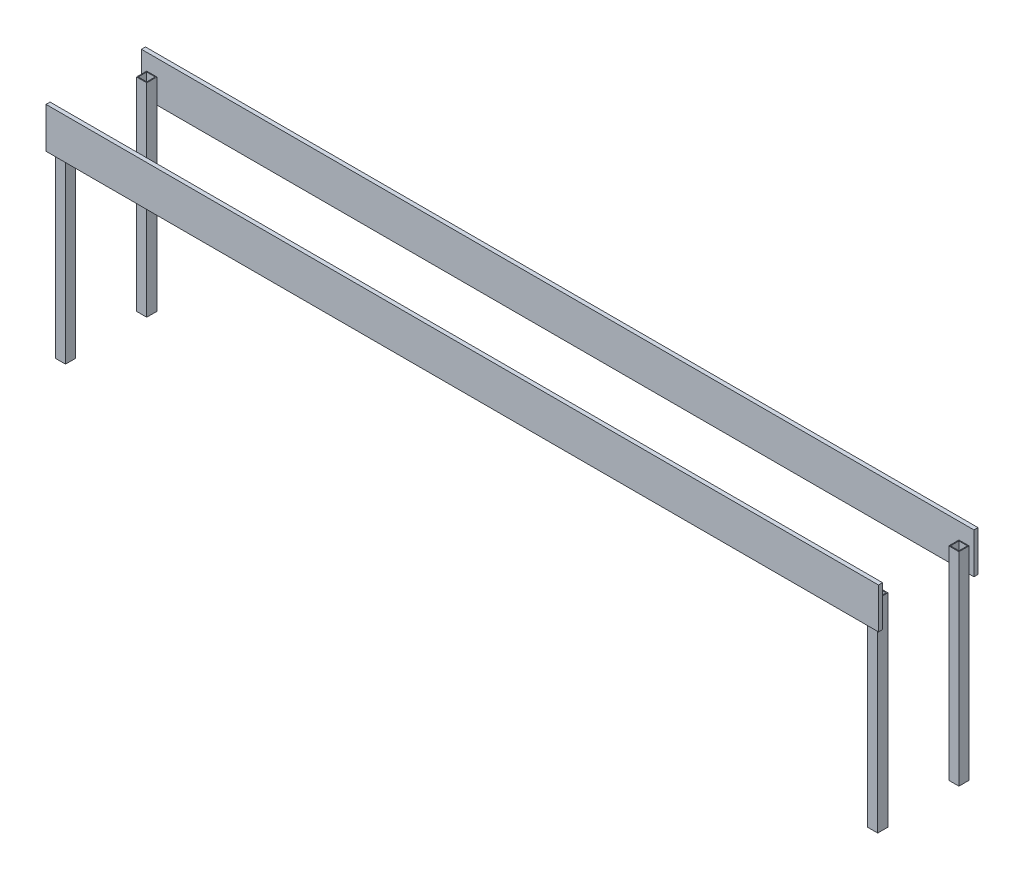
from build123d import *

# Parameters (mm, degrees)
SKIZZE2_W                         = 50
SKIZZE2_H                         = 50
SKIZZE2_W_2                       = 42
SKIZZE2_H_2                       = 42
AUFSATZ_LINEAR_AUSTRAGEN1_DEPTH   = 1000
AUFSATZ_LINEAR_AUSTRAGEN1_2_DEPTH = 1000
AUFSATZ_LINEAR_AUSTRAGEN1_3_DEPTH = 1000
AUFSATZ_LINEAR_AUSTRAGEN1_4_DEPTH = 1000
SKIZZE3_W                         = 4100
SKIZZE3_H                         = 200
AUFSATZ_LINEAR_AUSTRAGEN2_DEPTH   = 20
SKIZZE4_W                         = 4100
SKIZZE4_H                         = 200
AUFSATZ_LINEAR_AUSTRAGEN3_DEPTH   = 20


with BuildPart() as part:
    # Skizze2 → Aufsatz-Linear austragen1 (new body)
    with BuildSketch(Plane(origin=(0, 0, 0), x_dir=(1, 0, 0), z_dir=(0, 1, 0))):
        with Locations((-2000, 200)):
            Rectangle(SKIZZE2_W, SKIZZE2_H)
        with Locations((-2000, 200)):
            Rectangle(SKIZZE2_W_2, SKIZZE2_H_2, mode=Mode.SUBTRACT)
    extrude(amount=AUFSATZ_LINEAR_AUSTRAGEN1_DEPTH)



with BuildPart() as body_2:
    # Skizze2 → Aufsatz-Linear austragen1 2 (new body)
    with BuildSketch(Plane(origin=(0, 0, 0), x_dir=(1, 0, 0), z_dir=(0, 1, 0))):
        with Locations((-2000, -200)):
            Rectangle(SKIZZE2_W, SKIZZE2_H)
        with Locations((-2000, -200)):
            Rectangle(SKIZZE2_W_2, SKIZZE2_H_2, mode=Mode.SUBTRACT)
    extrude(amount=AUFSATZ_LINEAR_AUSTRAGEN1_2_DEPTH)



with BuildPart() as body_3:
    # Skizze2 → Aufsatz-Linear austragen1 3 (new body)
    with BuildSketch(Plane(origin=(0, 0, 0), x_dir=(1, 0, 0), z_dir=(0, 1, 0))):
        with Locations((2000, -200)):
            Rectangle(SKIZZE2_W, SKIZZE2_H)
        with Locations((2000, -200)):
            Rectangle(SKIZZE2_W_2, SKIZZE2_H_2, mode=Mode.SUBTRACT)
    extrude(amount=AUFSATZ_LINEAR_AUSTRAGEN1_3_DEPTH)


with BuildPart() as body_4:
    # Skizze2 → Aufsatz-Linear austragen1 4 (new body)
    with BuildSketch(Plane(origin=(0, 0, 0), x_dir=(1, 0, 0), z_dir=(0, 1, 0))):
        with Locations((2000, 200)):
            Rectangle(SKIZZE2_W, SKIZZE2_H)
        with Locations((2000, 200)):
            Rectangle(SKIZZE2_W_2, SKIZZE2_H_2, mode=Mode.SUBTRACT)
    extrude(amount=AUFSATZ_LINEAR_AUSTRAGEN1_4_DEPTH)


with BuildPart() as body_2_1:
    add(body_2.part)

    add(body_3.part)  # Aufsatz-Linear austragen2 merges body 3
    # Skizze3 → Aufsatz-Linear austragen2 (add)
    with BuildSketch(Plane.XY.offset(225)):
        with Locations((-1, 980)):
            Rectangle(SKIZZE3_W, SKIZZE3_H)
    extrude(amount=AUFSATZ_LINEAR_AUSTRAGEN2_DEPTH)


with BuildPart() as part_1:
    add(part.part)

    add(body_4.part)  # Aufsatz-Linear austragen3 merges body 4
    # Skizze4 → Aufsatz-Linear austragen3 (add)
    with BuildSketch(Plane.XY.offset(-225)):
        with Locations((-1, 980)):
            Rectangle(SKIZZE4_W, SKIZZE4_H)
    extrude(amount=-AUFSATZ_LINEAR_AUSTRAGEN3_DEPTH)


solid = Compound([body_2_1.part, part_1.part])
